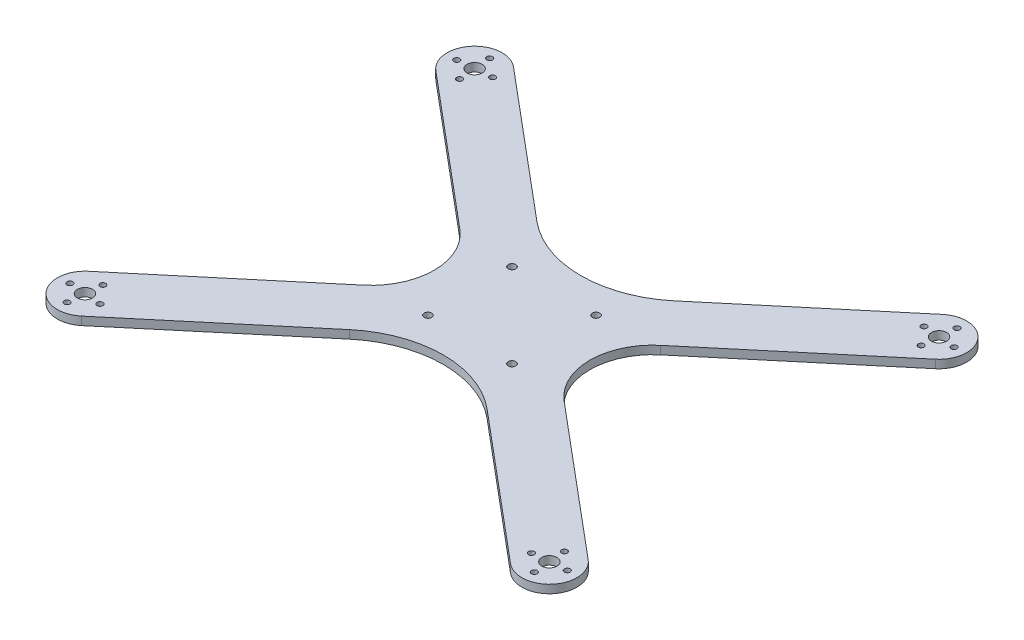
from build123d import *

# Parameters (mm, degrees)
SKETCH2_R           = 1.05
SKETCH2_R_2         = 2.75
BOSS_EXTRUDE2_DEPTH = 3
SKETCH4_R           = 1.375
CUT_EXTRUDE1_DEPTH  = 3


with BuildPart() as part:
    # Sketch2 → Boss-Extrude2 (new body)
    with BuildSketch(Plane(origin=(0, 0, 0), x_dir=(1, 0, 0), z_dir=(0, 1, 0))):
        with BuildLine():
            Line((-90.69276484, 63.046192634), (-36.412926139, 17.5))
            ThreePointArc((-36.412926139, 17.5), (-28.252542121, 0), (-36.412926139, -17.5))
            Line((-36.412926139, -17.5), (-90.69276484, -63.046192634))
            ThreePointArc((-90.69276484, -63.046192634), (-91.925333174, -77.134513162), (-77.837012646, -78.367081497))
            Line((-77.837012646, -78.367081497), (-25, -34.031563673))
            ThreePointArc((-25, -34.031563673), (0, -24.932307816), (25, -34.031563673))
            Line((25, -34.031563673), (77.837012646, -78.367081497))
            ThreePointArc((77.837012646, -78.367081497), (91.925333174, -77.134513162), (90.69276484, -63.046192634))
            Line((90.69276484, -63.046192634), (36.412926139, -17.5))
            ThreePointArc((36.412926139, -17.5), (28.252542121, 0), (36.412926139, 17.5))
            Line((36.412926139, 17.5), (90.69276484, 63.046192634))
            ThreePointArc((90.69276484, 63.046192634), (91.925333174, 77.134513162), (77.837012646, 78.367081497))
            Line((77.837012646, 78.367081497), (25, 34.031563673))
            ThreePointArc((25, 34.031563673), (0, 24.932307816), (-25, 34.031563673))
            Line((-25, 34.031563673), (-77.837012646, 78.367081497))
            ThreePointArc((-77.837012646, 78.367081497), (-91.925333174, 77.134513162), (-90.69276484, 63.046192634))
        make_face()
        with Locations(Location((-84.7878232, 76.683805254, 0), (0, 0, 270))):
            Circle(SKETCH2_R, mode=Mode.SUBTRACT)
        with Locations(Location((-78.287720555, 71.229571522, 0), (0, 0, 270))):
            Circle(SKETCH2_R, mode=Mode.SUBTRACT)
        with Locations(Location((-83.741954287, 64.729468877, 0), (0, 0, 270))):
            Circle(SKETCH2_R, mode=Mode.SUBTRACT)
        with Locations(Location((-90.242056932, 70.183702609, 0), (0, 0, 270))):
            Circle(SKETCH2_R, mode=Mode.SUBTRACT)
        with Locations(Location((-84.264888743, 70.706637066, 0), (0, 0, 270))):
            Circle(SKETCH2_R_2, mode=Mode.SUBTRACT)
        with Locations(Location((-84.7878232, -76.683805254, 0), (0, 0, 90))):
            Circle(SKETCH2_R, mode=Mode.SUBTRACT)
        with Locations(Location((-83.741954287, -64.729468877, 0), (0, 0, 90))):
            Circle(SKETCH2_R, mode=Mode.SUBTRACT)
        with Locations(Location((-90.242056932, -70.183702609, 0), (0, 0, 90))):
            Circle(SKETCH2_R, mode=Mode.SUBTRACT)
        with Locations(Location((-84.264888743, -70.706637066, 0), (0, 0, 90))):
            Circle(SKETCH2_R_2, mode=Mode.SUBTRACT)
        with Locations(Location((-78.287720555, -71.229571522, 0), (0, 0, 90))):
            Circle(SKETCH2_R, mode=Mode.SUBTRACT)
        with Locations(Location((78.287720555, -71.229571522, 0), (0, 0, 270))):
            Circle(SKETCH2_R, mode=Mode.SUBTRACT)
        with Locations(Location((84.264888743, -70.706637066, 0), (0, 0, 270))):
            Circle(SKETCH2_R_2, mode=Mode.SUBTRACT)
        with Locations(Location((90.242056932, -70.183702609, 0), (0, 0, 270))):
            Circle(SKETCH2_R, mode=Mode.SUBTRACT)
        with Locations(Location((83.741954287, -64.729468877, 0), (0, 0, 270))):
            Circle(SKETCH2_R, mode=Mode.SUBTRACT)
        with Locations(Location((84.7878232, -76.683805254, 0), (0, 0, 270))):
            Circle(SKETCH2_R, mode=Mode.SUBTRACT)
        with Locations(Location((84.264888743, 70.706637066, 0), (0, 0, 90))):
            Circle(SKETCH2_R_2, mode=Mode.SUBTRACT)
        with Locations(Location((90.242056932, 70.183702609, 0), (0, 0, 90))):
            Circle(SKETCH2_R, mode=Mode.SUBTRACT)
        with Locations(Location((83.741954287, 64.729468877, 0), (0, 0, 90))):
            Circle(SKETCH2_R, mode=Mode.SUBTRACT)
        with Locations(Location((78.287720555, 71.229571522, 0), (0, 0, 90))):
            Circle(SKETCH2_R, mode=Mode.SUBTRACT)
        with Locations(Location((84.7878232, 76.683805254, 0), (0, 0, 90))):
            Circle(SKETCH2_R, mode=Mode.SUBTRACT)
    extrude(amount=BOSS_EXTRUDE2_DEPTH)

    # Sketch4 → Cut-Extrude1 (cut)
    with BuildSketch(Plane(origin=(0, 0, 0), x_dir=(1, 0, 0), z_dir=(0, 1, 0))):
        with Locations(Location((-15.25, 15.25, 0), (0, 0, 270))):
            Circle(SKETCH4_R)
        with Locations(Location((15.25, -15.25, 0), (0, 0, 270))):
            Circle(SKETCH4_R)
        with Locations(Location((-15.25, -15.25, 0), (0, 0, 270))):
            Circle(SKETCH4_R)
        with Locations(Location((15.25, 15.25, 0), (0, 0, 270))):
            Circle(SKETCH4_R)
    extrude(amount=CUT_EXTRUDE1_DEPTH, mode=Mode.SUBTRACT)


solid = part.part
